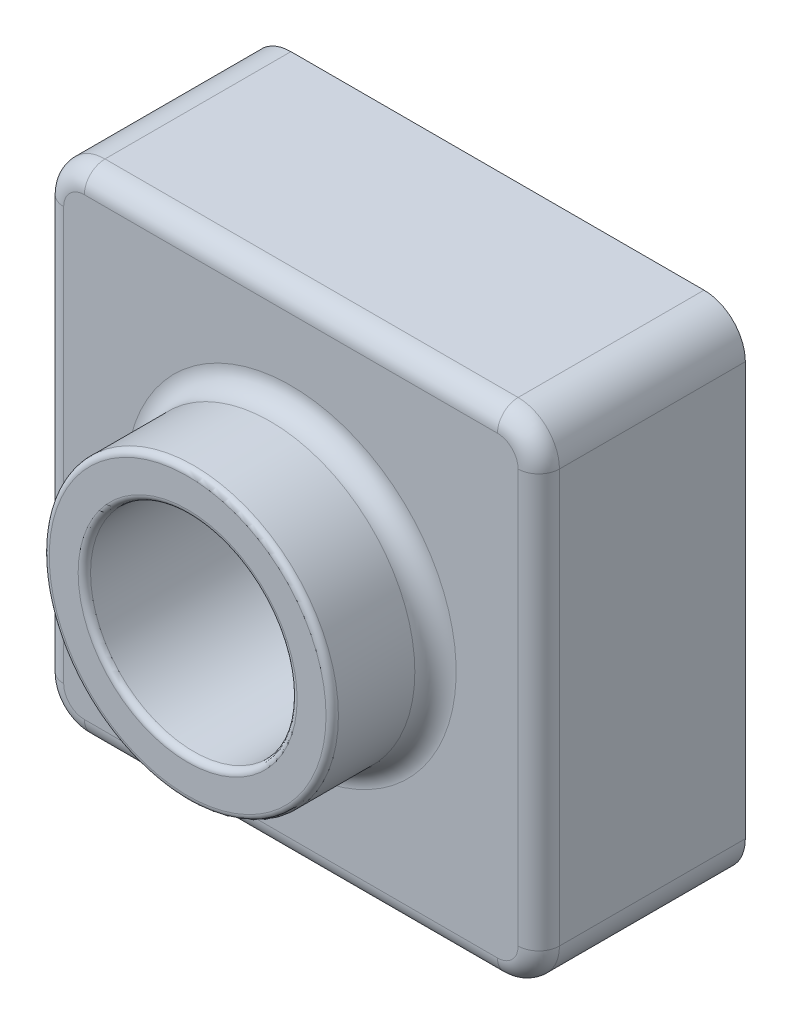
from build123d import *

# Parameters (mm, degrees)
SKETCH1_W           = 120
SKETCH1_H           = 120
BOSS_EXTRUDE1_DEPTH = 50
SKETCH2_R           = 35
BOSS_EXTRUDE2_DEPTH = 25
SKETCH3_R           = 25
CUT_EXTRUDE1_DEPTH  = 186.539753153
FILLET1_R           = 10
FILLET2_R           = 1.5
FILLET3_R           = 5
SHELL1_T            = -2


with BuildPart() as part:
    # Sketch1 → Boss-Extrude1 (new body)
    with BuildSketch(Plane.XY):
        with Locations((60, 60)):
            Rectangle(SKETCH1_W, SKETCH1_H)
    extrude(amount=BOSS_EXTRUDE1_DEPTH)

    # Sketch2 → Boss-Extrude2 (add)
    with BuildSketch(Plane.XY.offset(50)):
        with Locations((60, 60)):
            Circle(SKETCH2_R)
    extrude(amount=BOSS_EXTRUDE2_DEPTH)

    # Sketch3 → Cut-Extrude1 (cut, through all)
    with BuildSketch(Plane.XY.offset(75)):
        with Locations((60, 60)):
            Circle(SKETCH3_R)
    extrude(amount=-CUT_EXTRUDE1_DEPTH, mode=Mode.SUBTRACT)

    # Fillet1
    fillet1_edges = [part.edges().sort_by_distance(p)[0] for p in [
        (0, 120, 25),
        (120, 120, 25),
        (120, 0, 25),
        (0, 0, 25),
    ]]
    fillet(fillet1_edges, radius=FILLET1_R)

    # Fillet2
    fillet2_edges = [part.edges().sort_by_distance(p)[0] for p in [
        (25, 60, 75),
        (35, 60, 75),
    ]]
    fillet(fillet2_edges, radius=FILLET2_R)

    # Fillet3
    fillet3_edges = [part.edges().sort_by_distance(p)[0] for p in [
        (25, 60, 50),
        (0, 60, 50),
        (60, 120, 50),
        (60, 0, 50),
        (120, 60, 50),
        (117.071067812, 117.071067812, 50),
        (117.071067812, 2.928932188, 50),
        (2.928932188, 2.928932188, 50),
        (2.928932188, 117.071067812, 50),
    ]]
    fillet(fillet3_edges, radius=FILLET3_R)

    # Shell1
    shell1_openings = [part.faces().sort_by_distance(p)[0] for p in [
        (60, 1.697056275, 0),
    ]]
    offset(amount=SHELL1_T, openings=shell1_openings, kind=Kind.INTERSECTION)


solid = part.part
